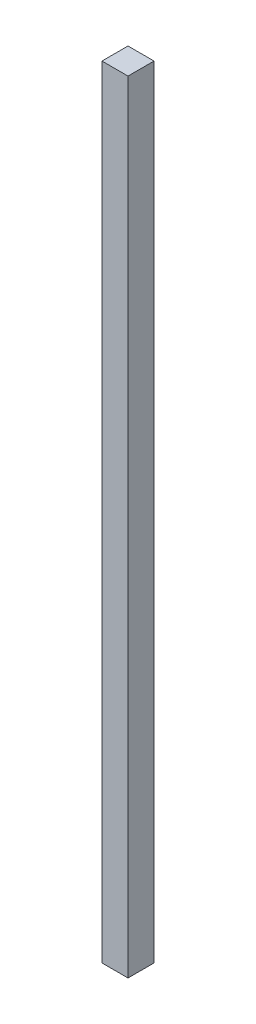
from build123d import *

# Parameters (mm, degrees)
SKETCH1_W           = 20
SKETCH1_H           = 20
BOSS_EXTRUDE1_DEPTH = 600


with BuildPart() as part:
    # Sketch1 → Boss-Extrude1 (new body)
    with BuildSketch(Plane(origin=(0, 0, 0), x_dir=(1, 0, 0), z_dir=(0, 1, 0))):
        with Locations((10, -10)):
            Rectangle(SKETCH1_W, SKETCH1_H)
    extrude(amount=BOSS_EXTRUDE1_DEPTH)


solid = part.part
